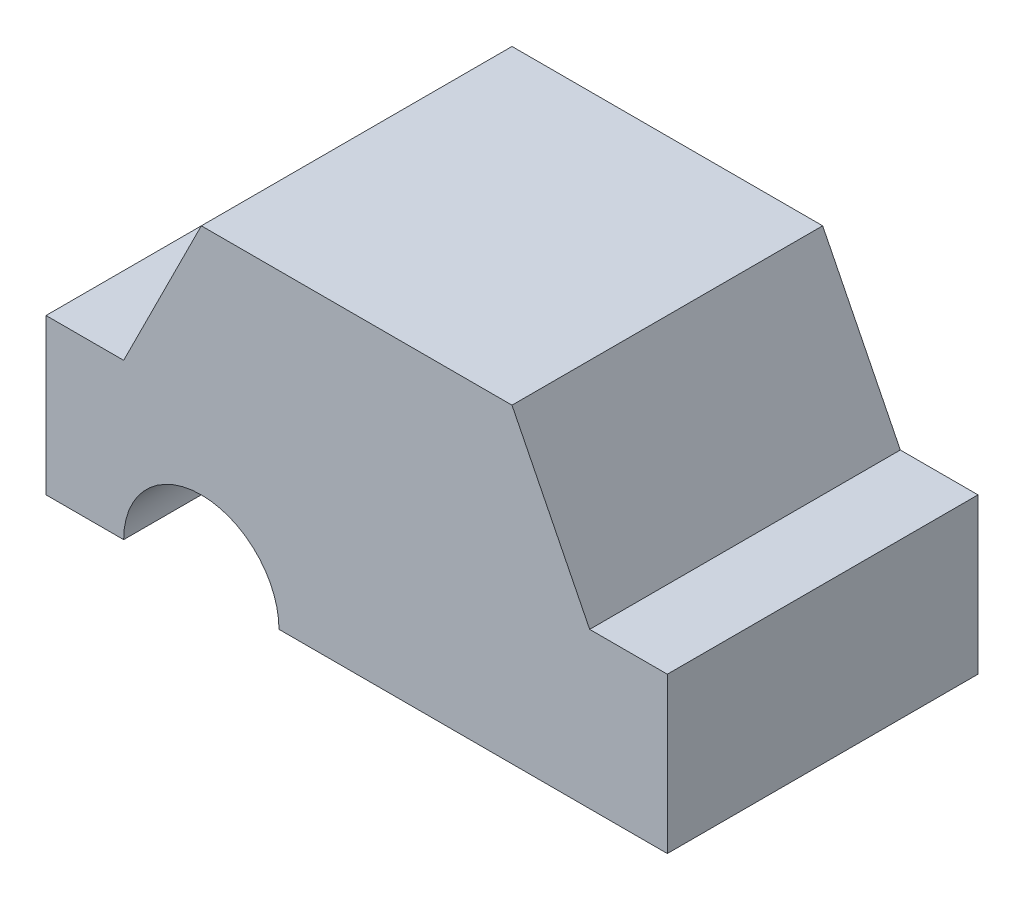
from build123d import *

# Parameters (mm, degrees)
BOSS_EXTRUDE1_DEPTH = 101.6


with BuildPart() as part:
    # Sketch1 → Boss-Extrude1 (new body)
    with BuildSketch(Plane.XY):
        with BuildLine():
            Line((-111.087162468, 18.269301554), (-111.087162468, -32.530698446))
            Line((-111.087162468, -32.530698446), (-85.687162468, -32.530698446))
            ThreePointArc((-85.687162468, -32.530698446), (-78.24767471, -14.570186204), (-60.287162468, -7.130698446))
            ThreePointArc((-60.287162468, -7.130698446), (-42.326650226, -14.570186204), (-34.887162468, -32.530698446))
            Line((-34.887162468, -32.530698446), (15.912837532, -32.530698446))
            Line((15.912837532, -32.530698446), (66.712837532, -32.530698446))
            Line((66.712837532, -32.530698446), (92.112837532, -32.530698446))
            Line((92.112837532, -32.530698446), (92.112837532, 18.269301554))
            Line((92.112837532, 18.269301554), (66.712837532, 18.269301554))
            Line((66.712837532, 18.269301554), (41.312837532, 69.069301554))
            Line((41.312837532, 69.069301554), (-60.287162468, 69.069301554))
            Line((-60.287162468, 69.069301554), (-85.687162468, 18.269301554))
            Line((-85.687162468, 18.269301554), (-111.087162468, 18.269301554))
        make_face()
    extrude(amount=BOSS_EXTRUDE1_DEPTH)


solid = part.part
